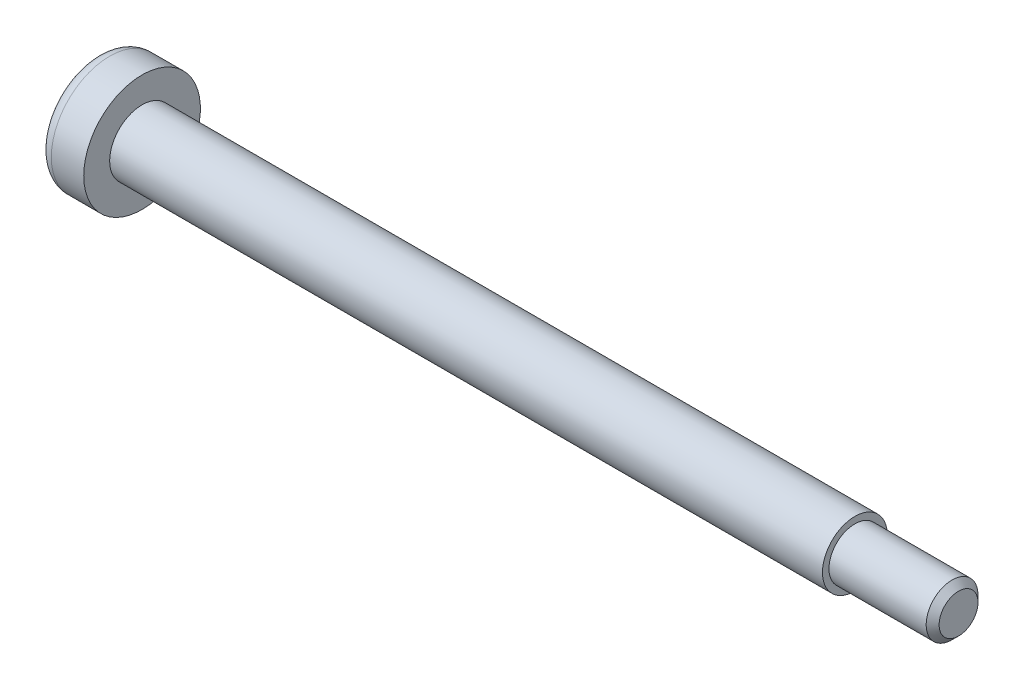
from build123d import *

# Parameters (mm, degrees)
CUT_EXTRUDE_1_DEPTH = 2.4
FILLET_1_R          = 1
CHAMFER_1_SIZE      = 0.5


with BuildPart() as part:
    # 草图1 → 旋转1 (revolve)
    with BuildSketch(Plane.XY, mode=Mode.PRIVATE) as revolve_1_sk:
        Polygon((0, 0), (0, 4.5), (3.5, 4.5), (3.5, 2.5), (58.5, 2.5), (58.5, 2), (66.5, 2), (66.5, 0), align=None)
    revolve(revolve_1_sk.sketch.rotate(Axis((0, 0, 0), (1, 0, 0)), 90), axis=Axis((0, 0, 0), (1, 0, 0)))

    # 草图2 → 切除-拉伸1 (cut)
    with BuildSketch(Plane.ZY):
        Polygon((0, 1.732050808), (-1.5, 0.866025404), (-1.5, -0.866025404), (0, -1.732050808), (1.5, -0.866025404), (1.5, 0.866025404), align=None)
    extrude(amount=-CUT_EXTRUDE_1_DEPTH, mode=Mode.SUBTRACT)

    # 圆角1
    fillet_1_edges = [part.edges().sort_by_distance(p)[0] for p in [
        (0, 0, -4.5),
    ]]
    fillet(fillet_1_edges, radius=FILLET_1_R)

    # 倒角1
    chamfer_1_edges = [part.edges().sort_by_distance(p)[0] for p in [
        (66.5, 0, -2),
    ]]
    chamfer(chamfer_1_edges, length=CHAMFER_1_SIZE)


solid = part.part
